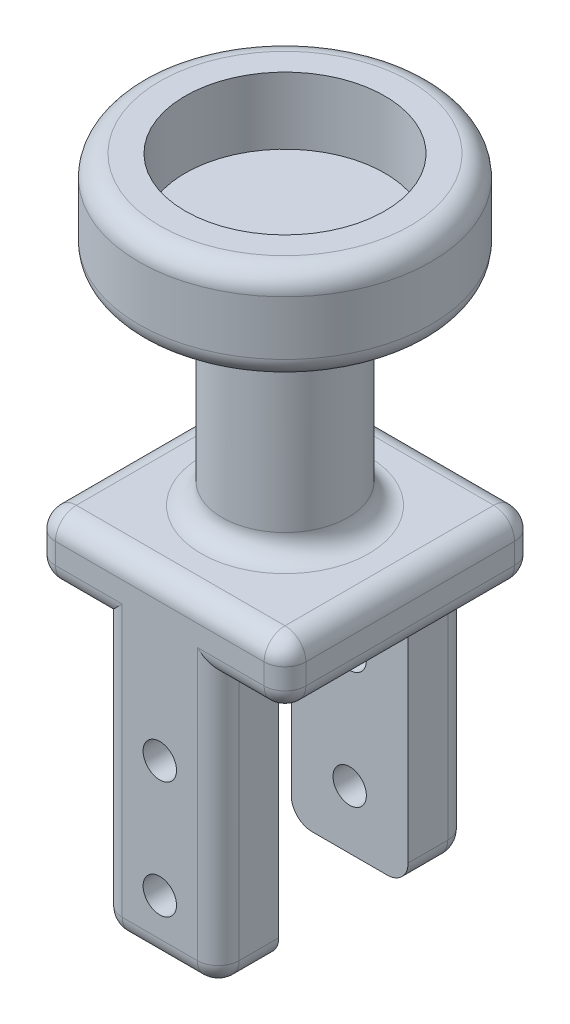
from build123d import *

# Parameters (mm, degrees)
SKETCH2_W           = 60
SKETCH2_H           = 60
BOSS_EXTRUDE1_DEPTH = 15
SKETCH3_R           = 15.085
BOSS_EXTRUDE2_DEPTH = 50
SKETCH4_R           = 35
BOSS_EXTRUDE3_DEPTH = 23
SKETCH5_R           = 23.9
CUT_EXTRUDE1_DEPTH  = 16
SKETCH8_W           = 28
SKETCH8_H           = 14.5
BOSS_EXTRUDE4_DEPTH = 65
SKETCH9_R           = 4
CUT_EXTRUDE2_DEPTH  = 65
FILLET1_R           = 5
FILLET2_R           = 5


with BuildPart() as part:
    # Sketch2 → Boss-Extrude1 (new body)
    with BuildSketch(Plane(origin=(0, 0, 0), x_dir=(1, 0, 0), z_dir=(0, 1, 0))):
        Rectangle(SKETCH2_W, SKETCH2_H)
    extrude(amount=BOSS_EXTRUDE1_DEPTH)

    # Sketch3 → Boss-Extrude2 (add)
    with BuildSketch(Plane(origin=(0, 15, 0), x_dir=(1, 0, 0), z_dir=(0, 1, 0))):
        with Locations(Location((0, 0, 0), (0, 0, 270))):
            Circle(SKETCH3_R)
    extrude(amount=BOSS_EXTRUDE2_DEPTH)

    # Sketch4 → Boss-Extrude3 (add)
    with BuildSketch(Plane(origin=(0, 65, 0), x_dir=(1, 0, 0), z_dir=(0, 1, 0))):
        with Locations(Location((0, 0, 0), (0, 0, 270))):
            Circle(SKETCH4_R)
    extrude(amount=BOSS_EXTRUDE3_DEPTH)

    # Sketch5 → Cut-Extrude1 (cut)
    with BuildSketch(Plane(origin=(0, 88, 0), x_dir=(1, 0, 0), z_dir=(0, 1, 0))):
        with Locations(Location((0, 0, 0), (0, 0, 270))):
            Circle(SKETCH5_R)
    extrude(amount=-CUT_EXTRUDE1_DEPTH, mode=Mode.SUBTRACT)

    # Sketch8 → Boss-Extrude4 (add)
    with BuildSketch(Plane.XZ):
        with Locations((0, -22.75)):
            Rectangle(SKETCH8_W, SKETCH8_H)
        with Locations((0, 22.75)):
            Rectangle(SKETCH8_W, SKETCH8_H)
    extrude(amount=BOSS_EXTRUDE4_DEPTH)

    # Sketch9 → Cut-Extrude2 (cut)
    with BuildSketch(Plane(origin=(0, 0, -30), x_dir=(-1, 0, 0), z_dir=(0, 0, -1))):
        with Locations((0, -51)):
            Circle(SKETCH9_R)
        with Locations((0, -23)):
            Circle(SKETCH9_R)
    extrude(amount=-CUT_EXTRUDE2_DEPTH, mode=Mode.SUBTRACT)

    # Fillet1
    fillet1_edges = [part.edges().sort_by_distance(p)[0] for p in [
        (-30, 15, 0),
        (0, 15, 30),
        (22, 0, 30),
        (-22, 0, -30),
        (14, -32.5, -30),
        (-14, -32.5, -30),
        (14, -65, -22.75),
        (-14, -65, -22.75),
        (0, -65, -30),
        (-14, -32.5, 30),
        (14, -32.5, 30),
        (-14, -65, 22.75),
        (14, -65, 22.75),
        (0, -65, 30),
        (30, 15, 0),
        (-22, 0, 30),
        (-30, 0, 0),
        (22, 0, -30),
        (30, 0, 0),
        (30, 7.5, 30),
        (-30, 7.5, 30),
        (30, 7.5, -30),
        (0, 15, -30),
    ]]
    fillet(fillet1_edges, radius=FILLET1_R)

    # Fillet2
    fillet2_edges = [part.edges().sort_by_distance(p)[0] for p in [
        (0, 15, -15.085),
        (0, 65, -15.085),
        (0, 65, -35),
        (0, 88, -35),
    ]]
    fillet(fillet2_edges, radius=FILLET2_R)


solid = part.part
